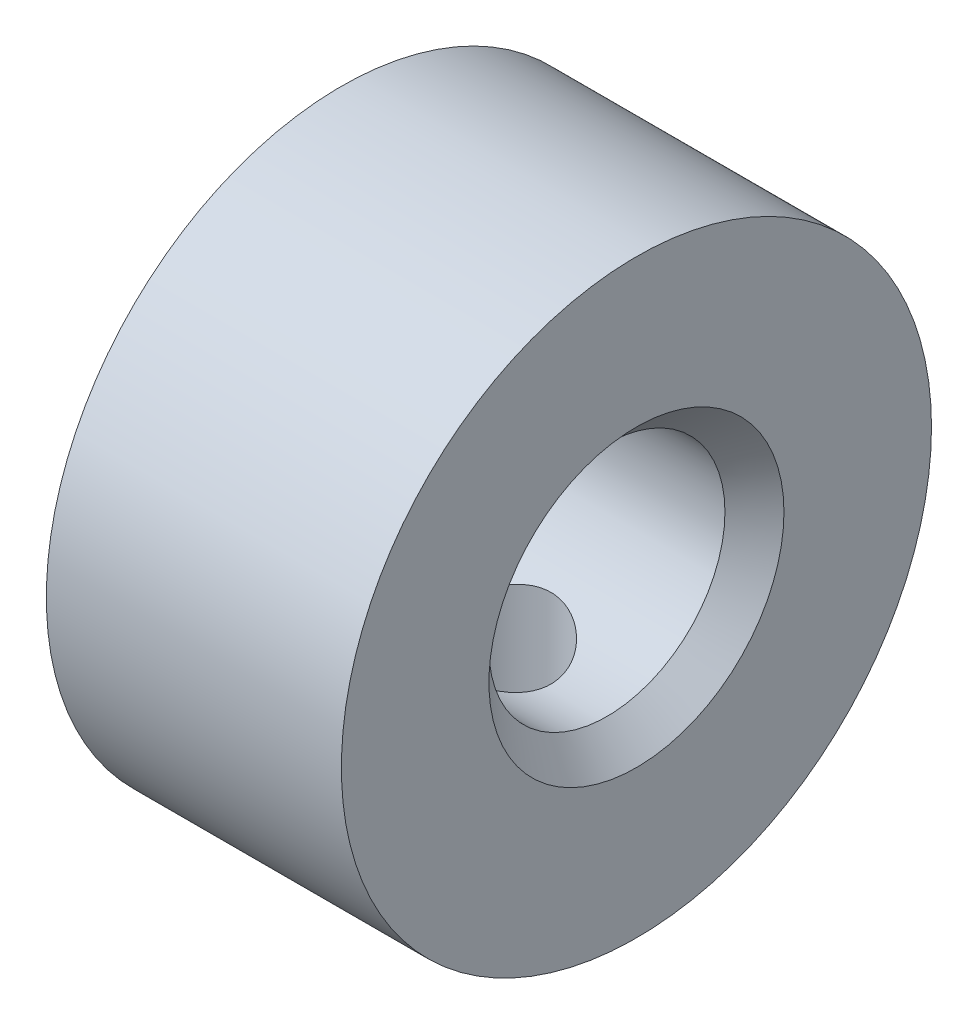
from build123d import *

# Parameters (mm, degrees)
SKETCH1_W                 = 10
SKETCH1_H                 = 10
F_8_0_8_DIAMETER_HOLE1_D  = 8
M5X0_8_TAPPED_HOLE1_D     = 4.2
M5X0_8_TAPPED_HOLE1_DEPTH = 6.59617233
CHAMFER1_SIZE             = 1


with BuildPart() as part:
    # Sketch1 → Revolve1 (revolve)
    with BuildSketch(Plane.XY, mode=Mode.PRIVATE) as revolve1_sk:
        with Locations((5, 5)):
            Rectangle(SKETCH1_W, SKETCH1_H)
    revolve(revolve1_sk.sketch.rotate(Axis((0, 0, 0), (1, 0, 0)), 270), axis=Axis((0, 0, 0), (1, 0, 0)))

    # Ø8.0 (8) Diameter Hole1 (through all)
    with Locations(Plane.ZY):
        with Locations((0, 0)):
            Hole(F_8_0_8_DIAMETER_HOLE1_D / 2)

    # M5x0.8 Tapped Hole1
    with Locations(Plane(origin=(0, -3.40382767, 0), x_dir=(1, 0, 0), z_dir=(0, 1, 0))):
        with Locations((5, 0.000941977)):
            Hole(M5X0_8_TAPPED_HOLE1_D / 2, depth=M5X0_8_TAPPED_HOLE1_DEPTH)

    # Chamfer1
    chamfer1_edges = [part.edges().sort_by_distance(p)[0] for p in [
        (0, 0, 4),
        (10, 0, 4),
    ]]
    chamfer(chamfer1_edges, length=CHAMFER1_SIZE)


solid = part.part
